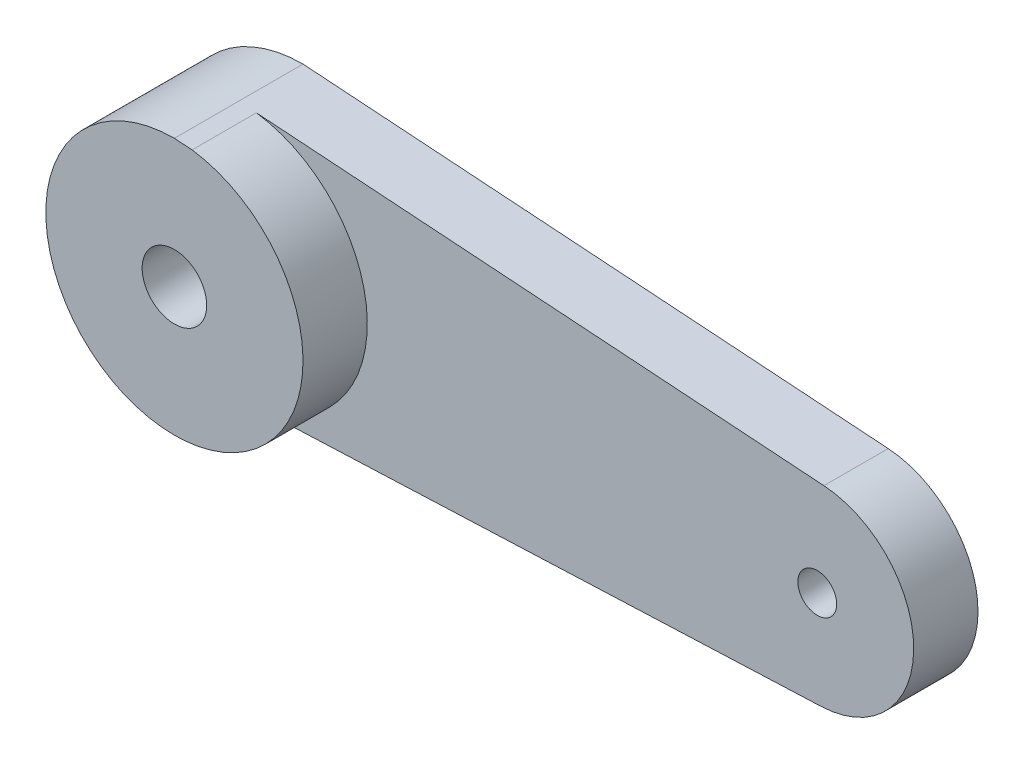
from build123d import *

# Parameters (mm, degrees)
SKETCH1_R           = 2.51
BOSS_EXTRUDE1_DEPTH = 10
SKETCH1_3_R         = 1.51
BOSS_EXTRUDE2_DEPTH = 5


with BuildPart() as part:
    # Sketch1 → Boss-Extrude1 (new body)
    with BuildSketch(Plane.XY):
        with BuildLine():
            Line((1.373905706, 9.905169514), (0, 10))
            ThreePointArc((0, 10), (-10, 0), (0, -10))
            Line((0, -10), (0.829742277, -9.965516934))
            ThreePointArc((0.829742277, -9.965516934), (7.3585808, -6.771357959), (10, 0))
            ThreePointArc((10, 0), (7.541188801, 6.567379346), (1.373905706, 9.905169514))
        make_face()
        Circle(SKETCH1_R, mode=Mode.SUBTRACT)
    extrude(amount=BOSS_EXTRUDE1_DEPTH)

    # Sketch1<3> → Boss-Extrude2 (add)
    with BuildSketch(Plane.XY):
        with BuildLine():
            Line((45.512119929, 6.858637088), (1.373905706, 9.905169514))
            ThreePointArc((1.373905706, 9.905169514), (9.996252352, -0.273749725), (0.829742277, -9.965516934))
            Line((0.829742277, -9.965516934), (45.307101416, -8.117092704))
            ThreePointArc((45.307101416, -8.117092704), (52.49497676, -0.726226835), (45.512119929, 6.858637088))
        make_face()
        with Locations((44.995679477, -0.623561069)):
            Circle(SKETCH1_3_R, mode=Mode.SUBTRACT)
    extrude(amount=BOSS_EXTRUDE2_DEPTH)


solid = part.part
